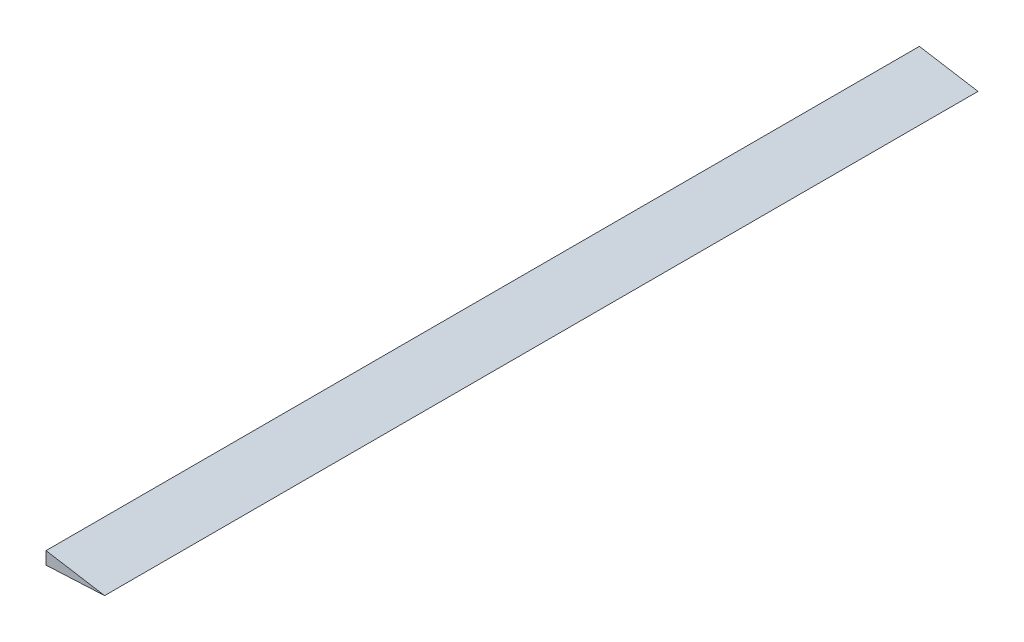
from build123d import *

# Parameters (mm, degrees)
BOSS_EXTRUDE2_DEPTH = 756.919746


with BuildPart() as part:
    # Sketch2 → Boss-Extrude2 (new body)
    with BuildSketch(Plane(origin=(0, 0, -761.999746), x_dir=(-1, 0, 0), z_dir=(0, 0, -1))):
        Polygon((-274.102693551, -2.525772554), (-274.102693551, 8.399511346), (-324.902693551, 0), align=None)
    extrude(amount=-BOSS_EXTRUDE2_DEPTH)


solid = part.part
